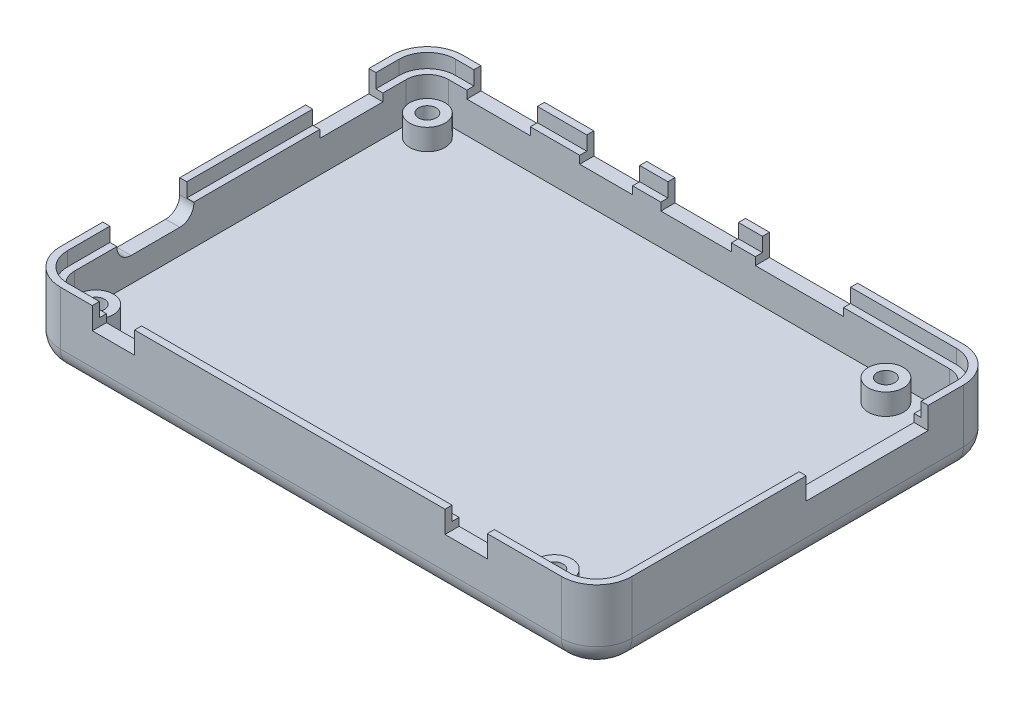
from build123d import *

# Parameters (mm, degrees)
SKETCH_4_W          = 81
SKETCH_4_H          = 57
SKETCH_4_R          = 1.25
EXTRUDE_5_DEPTH     = 3
EXTRUDE_START       = 3
SKETCH_4_4_R        = 2.5
SKETCH_4_4_R_2      = 1.25
EXTRUDE_6_DEPTH     = 3
SKETCH_4_5_W        = 81
SKETCH_4_5_H        = 57
SKETCH_4_5_W_2      = 77
SKETCH_4_5_H_2      = 53
EXTRUDE_7_DEPTH     = 10.6
SKETCH_6_W          = 12.5
SKETCH_6_H          = 3.1
SKETCH_6_W_2        = 10
SKETCH_6_W_3        = 7.5
SKETCH_6_W_4        = 9
CUT_EXTRUDE_1_DEPTH = 2
SKETCH_7_W          = 8.95
SKETCH_7_H          = 3.1
SKETCH_7_W_2        = 8.9
CUT_EXTRUDE_2_DEPTH = 2
FILLET_1_R          = 2
SKETCH_8_W          = 6
SKETCH_8_H          = 3.1
CUT_EXTRUDE_3_DEPTH = 2
SKETCH_9_W          = 17.3
SKETCH_9_H          = 3.1
CUT_EXTRUDE_4_DEPTH = 2
FILLET_2_R          = 3
FILLET_3_R          = 5
FILLET_4_R          = 3
CUT_EXTRUDE_5_DEPTH = 2
SKETCH_11_W         = 44
SKETCH_11_H         = 1
CUT_EXTRUDE_6_DEPTH = 2


with BuildPart() as part:
    # 草图4 → 凸台-拉伸5 (new body)
    with BuildSketch(Plane(origin=(0, 0, 0), x_dir=(1, 0, 0), z_dir=(0, 1, 0))):
        with Locations((-80.045972017, 113.056664423)):
            Rectangle(SKETCH_4_W, SKETCH_4_H)
        with Locations(Location((-115.545972017, 136.556664423, 0), (0, 0, 270))):
            Circle(SKETCH_4_R, mode=Mode.SUBTRACT)
        with Locations(Location((-50.545972017, 136.556664423, 0), (0, 0, 270))):
            Circle(SKETCH_4_R, mode=Mode.SUBTRACT)
        with Locations(Location((-50.545972017, 89.556664423, 0), (0, 0, 270))):
            Circle(SKETCH_4_R, mode=Mode.SUBTRACT)
        with Locations(Location((-115.545972017, 89.556664423, 0), (0, 0, 270))):
            Circle(SKETCH_4_R, mode=Mode.SUBTRACT)
    extrude(amount=EXTRUDE_5_DEPTH)

    # 草图4<4> → 凸台-拉伸6 (add)
    # profile 1 of 4: a face of its own
    with BuildSketch(Plane(origin=(0, 0, 0), x_dir=(1, 0, 0), z_dir=(0, 1, 0)).offset(EXTRUDE_START)):
        with Locations(Location((-50.545972017, 89.556664423, 0), (0, 0, 90))):
            Circle(SKETCH_4_4_R)
        with Locations(Location((-50.545972017, 89.556664423, 0), (0, 0, 90))):
            Circle(SKETCH_4_4_R_2, mode=Mode.SUBTRACT)
    # profile 2 of 4: a face of its own
    with BuildSketch(Plane(origin=(0, 0, 0), x_dir=(1, 0, 0), z_dir=(0, 1, 0)).offset(EXTRUDE_START)):
        with Locations(Location((-115.545972017, 89.556664423, 0), (0, 0, 90))):
            Circle(SKETCH_4_4_R)
        with Locations(Location((-115.545972017, 89.556664423, 0), (0, 0, 90))):
            Circle(SKETCH_4_4_R_2, mode=Mode.SUBTRACT)
    # profile 3 of 4: a face of its own
    with BuildSketch(Plane(origin=(0, 0, 0), x_dir=(1, 0, 0), z_dir=(0, 1, 0)).offset(EXTRUDE_START)):
        with Locations(Location((-50.545972017, 136.556664423, 0), (0, 0, 90))):
            Circle(SKETCH_4_4_R)
        with Locations(Location((-50.545972017, 136.556664423, 0), (0, 0, 90))):
            Circle(SKETCH_4_4_R_2, mode=Mode.SUBTRACT)
    # profile 4 of 4: a face of its own
    with BuildSketch(Plane(origin=(0, 0, 0), x_dir=(1, 0, 0), z_dir=(0, 1, 0)).offset(EXTRUDE_START)):
        with Locations(Location((-115.545972017, 136.556664423, 0), (0, 0, 90))):
            Circle(SKETCH_4_4_R)
        with Locations(Location((-115.545972017, 136.556664423, 0), (0, 0, 90))):
            Circle(SKETCH_4_4_R_2, mode=Mode.SUBTRACT)
    extrude(amount=EXTRUDE_6_DEPTH)

    # 草图4<5> → 凸台-拉伸7 (add)
    with BuildSketch(Plane(origin=(0, 0, 0), x_dir=(1, 0, 0), z_dir=(0, 1, 0))):
        with Locations((-80.045972017, 113.056664423)):
            Rectangle(SKETCH_4_5_W, SKETCH_4_5_H)
        with Locations((-80.045972017, 113.056664423)):
            Rectangle(SKETCH_4_5_W_2, SKETCH_4_5_H_2, mode=Mode.SUBTRACT)
    extrude(amount=EXTRUDE_7_DEPTH)

    # 草图6 → 切除-拉伸1 (cut)
    with BuildSketch(Plane(origin=(0, 0, -141.556664423), x_dir=(-1, 0, 0), z_dir=(0, 0, -1))):
        with Locations((65.795972017, 9.05)):
            Rectangle(SKETCH_6_W, SKETCH_6_H)
        with Locations((80.445972017, 9.05)):
            Rectangle(SKETCH_6_W_2, SKETCH_6_H)
        with Locations((93.195972017, 9.05)):
            Rectangle(SKETCH_6_W_3, SKETCH_6_H)
        with Locations((108.445972017, 9.05)):
            Rectangle(SKETCH_6_W_4, SKETCH_6_H)
    extrude(amount=-CUT_EXTRUDE_1_DEPTH, mode=Mode.SUBTRACT)

    # 草图7 → 切除-拉伸2 (cut)
    with BuildSketch(Plane.ZY.offset(120.545972017)):
        with Locations((-128.781664423, 9.05)):
            Rectangle(SKETCH_7_W, SKETCH_7_H)
        with Locations((-101.006664423, 9.05)):
            Rectangle(SKETCH_7_W_2, SKETCH_7_H)
        Polygon((-105.456664423, 10.6), (-106.456664423, 10.6), (-106.456664423, 6.5), (-95.556664423, 6.5), (-95.556664423, 10.6), (-96.556664423, 10.6), (-96.556664423, 7.5), (-105.456664423, 7.5), align=None)
    extrude(amount=-CUT_EXTRUDE_2_DEPTH, mode=Mode.SUBTRACT)

    # 圆角1
    fillet_1_edges = [part.edges().sort_by_distance(p)[0] for p in [
        (-119.545972017, 6.5, -95.556664423),
        (-119.545972017, 6.5, -106.456664423),
    ]]
    fillet(fillet_1_edges, radius=FILLET_1_R)

    # 草图8 → 切除-拉伸3 (cut)
    with BuildSketch(Plane.XY.offset(-84.556664423)):
        with Locations((-108.045972017, 9.05)):
            Rectangle(SKETCH_8_W, SKETCH_8_H)
        with Locations((-58.045972017, 9.05)):
            Rectangle(SKETCH_8_W, SKETCH_8_H)
    extrude(amount=-CUT_EXTRUDE_3_DEPTH, mode=Mode.SUBTRACT)

    # 草图9 → 切除-拉伸4 (cut)
    with BuildSketch(Plane(origin=(-39.545972017, 0, 0), x_dir=(0, 0, -1), z_dir=(1, 0, 0))):
        with Locations((122.906664423, 9.05)):
            Rectangle(SKETCH_9_W, SKETCH_9_H)
    extrude(amount=-CUT_EXTRUDE_4_DEPTH, mode=Mode.SUBTRACT)

    # 圆角2
    fillet_2_edges = [part.edges().sort_by_distance(p)[0] for p in [
        (-118.545972017, 6.8, -139.556664423),
        (-41.545972017, 6.8, -139.556664423),
        (-41.545972017, 6.8, -86.556664423),
        (-118.545972017, 6.8, -86.556664423),
    ]]
    fillet(fillet_2_edges, radius=FILLET_2_R)

    # 圆角3
    fillet_3_edges = [part.edges().sort_by_distance(p)[0] for p in [
        (-120.545972017, 5.3, -141.556664423),
        (-120.545972017, 5.3, -84.556664423),
        (-39.545972017, 5.3, -84.556664423),
        (-39.545972017, 5.3, -141.556664423),
    ]]
    fillet(fillet_3_edges, radius=FILLET_3_R)

    # 圆角4
    fillet_4_edges = [part.edges().sort_by_distance(p)[0] for p in [
        (-80.045972017, 0, -84.556664423),
        (-80.045972017, 0, -141.556664423),
        (-39.545972017, 0, -113.056664423),
        (-120.545972017, 0, -113.056664423),
        (-119.081505923, 0, -140.092198329),
        (-41.010438111, 0, -140.092198329),
        (-41.010438111, 0, -86.021130517),
        (-119.081505923, 0, -86.021130517),
    ]]
    fillet(fillet_4_edges, radius=FILLET_4_R)

    # 草图10 → 切除-拉伸5 (cut)
    with BuildSketch(Plane.XZ):
        Polygon((-48.045972017, -89.556664423), (-49.295972017, -87.391600913), (-51.795972017, -87.391600913), (-53.045972017, -89.556664423), (-51.795972017, -91.721727932), (-49.295972017, -91.721727932), align=None)
        Polygon((-113.045972017, -89.556664423), (-114.295972017, -87.391600913), (-116.795972017, -87.391600913), (-118.045972017, -89.556664423), (-116.795972017, -91.721727932), (-114.295972017, -91.721727932), align=None)
        Polygon((-113.045972017, -136.556664423), (-114.295972017, -134.391600913), (-116.795972017, -134.391600913), (-118.045972017, -136.556664423), (-116.795972017, -138.721727932), (-114.295972017, -138.721727932), align=None)
        Polygon((-48.045972017, -136.556664423), (-49.295972017, -134.391600913), (-51.795972017, -134.391600913), (-53.045972017, -136.556664423), (-51.795972017, -138.721727932), (-49.295972017, -138.721727932), align=None)
    extrude(amount=-CUT_EXTRUDE_5_DEPTH, mode=Mode.SUBTRACT)

    # 草图11 → 切除-拉伸6 (cut)
    with BuildSketch(Plane(origin=(0, 10.6, 0), x_dir=(1, 0, 0), z_dir=(0, 1, 0))):
        with BuildLine():
            Line((-41.261655488, 87.273406895), (-42.082349142, 87.844775895))
            ThreePointArc((-42.082349142, 87.844775895), (-43.155947841, 86.898124825), (-44.545972017, 86.556664423))
            Line((-44.545972017, 86.556664423), (-61.045972017, 86.556664423))
            Line((-61.045972017, 86.556664423), (-61.045972017, 85.556664423))
            Line((-61.045972017, 85.556664423), (-44.545972017, 85.556664423))
            ThreePointArc((-44.545972017, 85.556664423), (-42.693005491, 86.011736348), (-41.261655488, 87.273406895))
        make_face()
        with BuildLine():
            ThreePointArc((-40.545972017, 136.556664423), (-41.168680103, 138.700002783), (-42.842921681, 140.17600408))
            Line((-42.842921681, 140.17600408), (-43.850059004, 139.474832526))
            ThreePointArc((-43.850059004, 139.474832526), (-42.1914297, 138.415731522), (-41.545972017, 136.556664423))
            Line((-41.545972017, 136.556664423), (-41.545972017, 89.556664423))
            ThreePointArc((-41.545972017, 89.556664423), (-41.683205119, 88.659688566), (-42.082349142, 87.844775895))
            Line((-42.082349142, 87.844775895), (-41.261655488, 87.273406895))
            ThreePointArc((-41.261655488, 87.273406895), (-40.729084141, 88.360266938), (-40.545972017, 89.556664423))
            Line((-40.545972017, 89.556664423), (-40.545972017, 136.556664423))
        make_face()
        with BuildLine():
            Line((-44.545972017, 140.556664423), (-115.545972017, 140.556664423))
            ThreePointArc((-115.545972017, 140.556664423), (-116.418508942, 140.460339526), (-117.249022353, 140.17600408))
            Line((-117.249022353, 140.17600408), (-116.24188503, 139.474832526))
            ThreePointArc((-116.24188503, 139.474832526), (-115.896325903, 139.536136214), (-115.545972017, 139.556664423))
            Line((-115.545972017, 139.556664423), (-44.545972017, 139.556664423))
            ThreePointArc((-44.545972017, 139.556664423), (-44.195618131, 139.536136214), (-43.850059004, 139.474832526))
            Line((-43.850059004, 139.474832526), (-42.842921681, 140.17600408))
            ThreePointArc((-42.842921681, 140.17600408), (-43.673435092, 140.460339526), (-44.545972017, 140.556664423))
        make_face()
        with BuildLine():
            Line((-116.24188503, 139.474832526), (-117.249022353, 140.17600408))
            ThreePointArc((-117.249022353, 140.17600408), (-118.923263931, 138.700002783), (-119.545972017, 136.556664423))
            Line((-119.545972017, 136.556664423), (-119.545972017, 89.556664423))
            ThreePointArc((-119.545972017, 89.556664423), (-119.362859893, 88.360266938), (-118.830288546, 87.273406895))
            Line((-118.830288546, 87.273406895), (-118.009594892, 87.844775895))
            ThreePointArc((-118.009594892, 87.844775895), (-118.408738915, 88.659688566), (-118.545972017, 89.556664423))
            Line((-118.545972017, 89.556664423), (-118.545972017, 136.556664423))
            ThreePointArc((-118.545972017, 136.556664423), (-117.900514333, 138.415731522), (-116.24188503, 139.474832526))
        make_face()
        with BuildLine():
            ThreePointArc((-115.545972017, 86.556664423), (-116.935996192, 86.898124825), (-118.009594892, 87.844775895))
            Line((-118.009594892, 87.844775895), (-118.830288546, 87.273406895))
            ThreePointArc((-118.830288546, 87.273406895), (-117.398938542, 86.011736348), (-115.545972017, 85.556664423))
            Line((-115.545972017, 85.556664423), (-105.045972017, 85.556664423))
            Line((-105.045972017, 85.556664423), (-105.045972017, 86.556664423))
            Line((-105.045972017, 86.556664423), (-115.545972017, 86.556664423))
        make_face()
        with Locations((-83.045972017, 86.056664423)):
            Rectangle(SKETCH_11_W, SKETCH_11_H)
    extrude(amount=-CUT_EXTRUDE_6_DEPTH, mode=Mode.SUBTRACT)


solid = part.part
